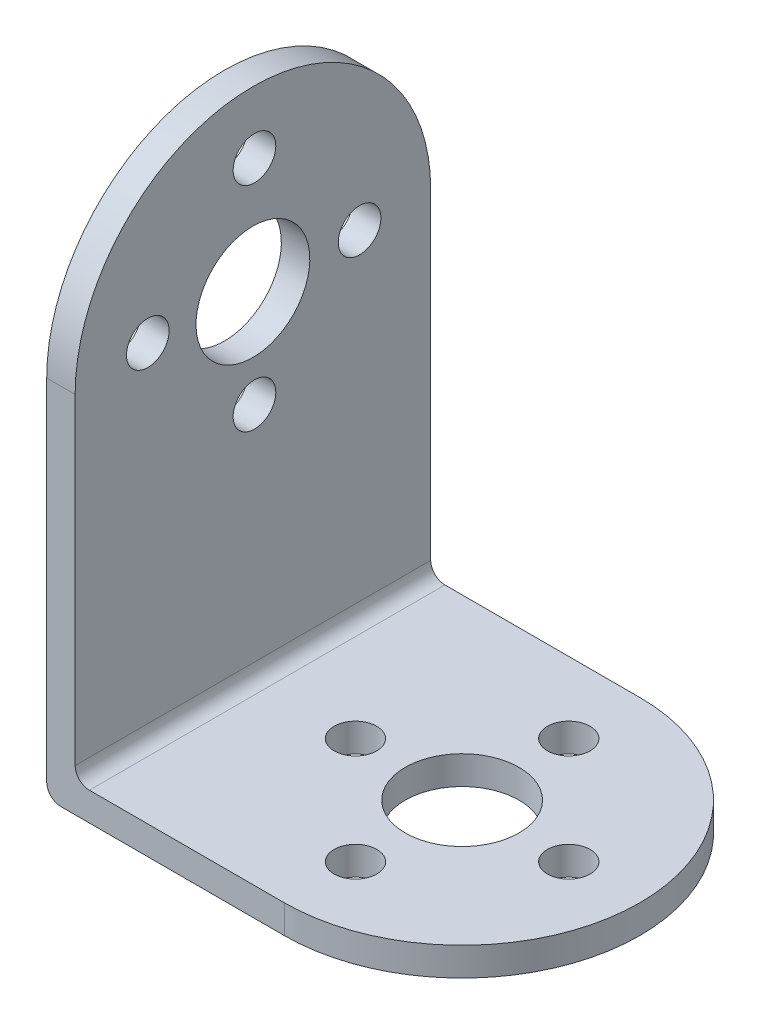
from build123d import *

# Parameters (mm, degrees)
SKETCH1_W           = 27.21
SKETCH1_H           = 2
BOSS_EXTRUDE1_DEPTH = 25
SKETCH2_R           = 1.5
SKETCH2_R_2         = 4
CUT_EXTRUDE1_DEPTH  = 25
SKETCH3_R           = 1.5
SKETCH3_R_2         = 4
CUT_EXTRUDE3_DEPTH  = 25
FILLET1_R           = 1


with BuildPart() as part:
    # Sketch1 → Boss-Extrude1 (new body)
    with BuildSketch(Plane.XY):
        Polygon((2, 2), (2, 38.1), (0, 38.1), (0, 0), (2, 0), align=None)
        with Locations((15.605, 1)):
            Rectangle(SKETCH1_W, SKETCH1_H)
    extrude(amount=BOSS_EXTRUDE1_DEPTH)

    # Sketch2 → Cut-Extrude1 (cut)
    with BuildSketch(Plane(origin=(0, 2, 0), x_dir=(1, 0, 0), z_dir=(0, 1, 0))):
        with Locations(Location((16.71, -20, 0), (0, 0, 270))):
            Circle(SKETCH2_R)
        with Locations(Location((9.21, -12.5, 0), (0, 0, 270))):
            Circle(SKETCH2_R)
        with Locations(Location((16.71, -5, 0), (0, 0, 270))):
            Circle(SKETCH2_R)
        with Locations(Location((24.21, -12.5, 0), (0, 0, 270))):
            Circle(SKETCH2_R)
        with Locations(Location((16.71, -12.5, 0), (0, 0, 270))):
            Circle(SKETCH2_R_2)
        with BuildLine():
            Line((29.21, -12.5), (29.21, 0))
            Line((29.21, 0), (16.71, 0))
            ThreePointArc((16.71, 0), (25.548834765, -3.661165235), (29.21, -12.5))
        make_face()
        with BuildLine():
            Line((29.21, -25), (29.21, -12.5))
            ThreePointArc((29.21, -12.5), (25.548834765, -21.338834765), (16.71, -25))
            Line((16.71, -25), (29.21, -25))
        make_face()
    extrude(amount=-CUT_EXTRUDE1_DEPTH, mode=Mode.SUBTRACT)

    # Sketch3 → Cut-Extrude3 (cut)
    with BuildSketch(Plane(origin=(2, 0, 0), x_dir=(0, 0, -1), z_dir=(1, 0, 0))):
        with BuildLine():
            ThreePointArc((-25, 25.599999976), (-21.338834773, 34.438834756), (-12.5, 38.1))
            Line((-12.5, 38.1), (-25, 38.1))
            Line((-25, 38.1), (-25, 25.599999976))
        make_face()
        with BuildLine():
            Line((0, 25.6), (0, 38.1))
            Line((0, 38.1), (-12.5, 38.1))
            ThreePointArc((-12.5, 38.1), (-3.661165235, 34.438834765), (0, 25.6))
        make_face()
        with Locations(Location((-12.390951319, 33.683987084, 0), (0, 0, 90))):
            Circle(SKETCH3_R)
        with Locations(Location((-5, 25.6, 0), (0, 0, 90))):
            Circle(SKETCH3_R)
        with Locations(Location((-19.890951319, 26.183987084, 0), (0, 0, 90))):
            Circle(SKETCH3_R)
        with Locations(Location((-12.5, 25.6, 0), (0, 0, 90))):
            Circle(SKETCH3_R_2)
        with Locations(Location((-12.390951319, 18.683987084, 0), (0, 0, 90))):
            Circle(SKETCH3_R)
    extrude(amount=-CUT_EXTRUDE3_DEPTH, mode=Mode.SUBTRACT)

    # Fillet1
    fillet1_edges = [part.edges().sort_by_distance(p)[0] for p in [
        (2, 2, 12.5),
        (0, 0, 12.5),
    ]]
    fillet(fillet1_edges, radius=FILLET1_R)


solid = part.part
